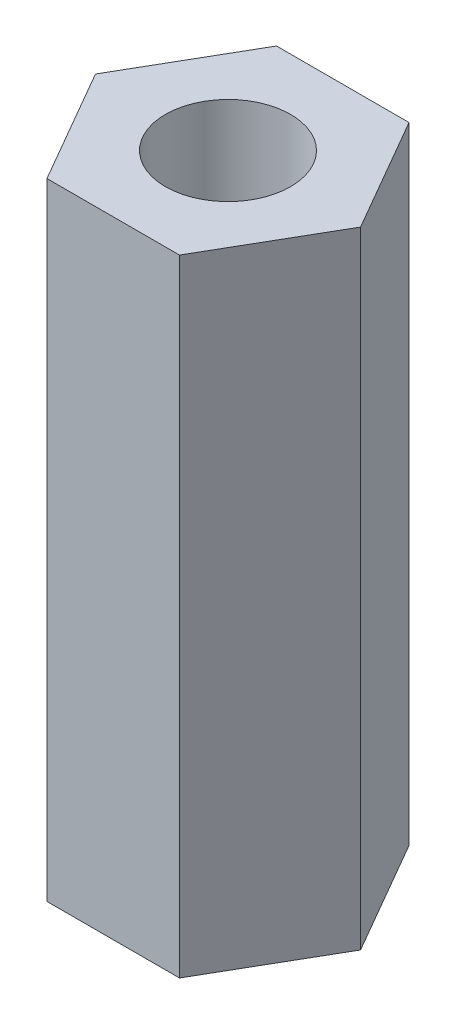
from build123d import *

# Parameters (mm, degrees)
BOSS_EXTRUDE1_DEPTH = 15
SKETCH2_R           = 1.5
CUT_EXTRUDE1_DEPTH  = 10


with BuildPart() as part:
    # Sketch1 → Boss-Extrude1 (new body)
    with BuildSketch(Plane(origin=(0, 0, 0), x_dir=(1, 0, 0), z_dir=(0, 1, 0))):
        Polygon((3.175426481, 0), (1.58771324, 2.75), (-1.58771324, 2.75), (-3.175426481, 0), (-1.58771324, -2.75), (1.58771324, -2.75), align=None)
    extrude(amount=BOSS_EXTRUDE1_DEPTH)

    # Sketch2 → Cut-Extrude1 (cut)
    with BuildSketch(Plane(origin=(0, 15, 0), x_dir=(1, 0, 0), z_dir=(0, 1, 0))):
        with Locations(Location((0, 0, 0), (0, 0, 270))):
            Circle(SKETCH2_R)
    cut_extrude1 = extrude(amount=-CUT_EXTRUDE1_DEPTH, mode=Mode.SUBTRACT)

    # Mirror1: Cut-Extrude1 across plane
    add(cut_extrude1.mirror(Plane(origin=(0, 7.5, 0), x_dir=(0, 0, 1), z_dir=(0, -1, 0))), mode=Mode.SUBTRACT)


solid = part.part
